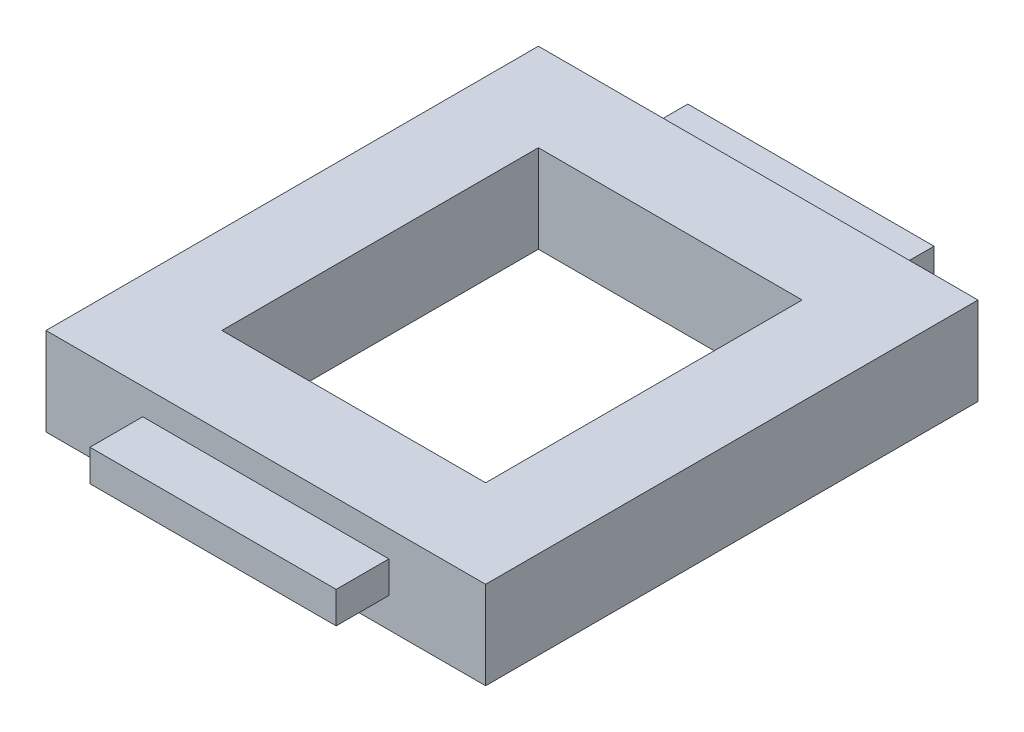
from build123d import *

# Parameters (mm, degrees)
SKETCH1_W           = 25
SKETCH1_H           = 28
SKETCH1_W_2         = 15
SKETCH1_H_2         = 18
BOSS_EXTRUDE1_DEPTH = 5
SKETCH2_W           = 14
SKETCH2_H           = 1.8
BOSS_EXTRUDE2_DEPTH = 3
SKETCH3_W           = 14
SKETCH3_H           = 1.8
BOSS_EXTRUDE3_DEPTH = 3


with BuildPart() as part:
    # Sketch1 → Boss-Extrude1 (new body)
    with BuildSketch(Plane(origin=(0, 0, 0), x_dir=(1, 0, 0), z_dir=(0, 1, 0))):
        with Locations((12.5, 14)):
            Rectangle(SKETCH1_W, SKETCH1_H)
        with Locations((12.5, 14)):
            Rectangle(SKETCH1_W_2, SKETCH1_H_2, mode=Mode.SUBTRACT)
    extrude(amount=BOSS_EXTRUDE1_DEPTH)

    # Sketch2 → Boss-Extrude2 (add)
    with BuildSketch(Plane.XY):
        with Locations((12.5, 2.6)):
            Rectangle(SKETCH2_W, SKETCH2_H)
    extrude(amount=BOSS_EXTRUDE2_DEPTH)

    # Sketch3 → Boss-Extrude3 (add)
    with BuildSketch(Plane(origin=(0, 0, -28), x_dir=(-1, 0, 0), z_dir=(0, 0, -1))):
        with Locations((-12.5, 2.5)):
            Rectangle(SKETCH3_W, SKETCH3_H)
    extrude(amount=BOSS_EXTRUDE3_DEPTH)


solid = part.part
